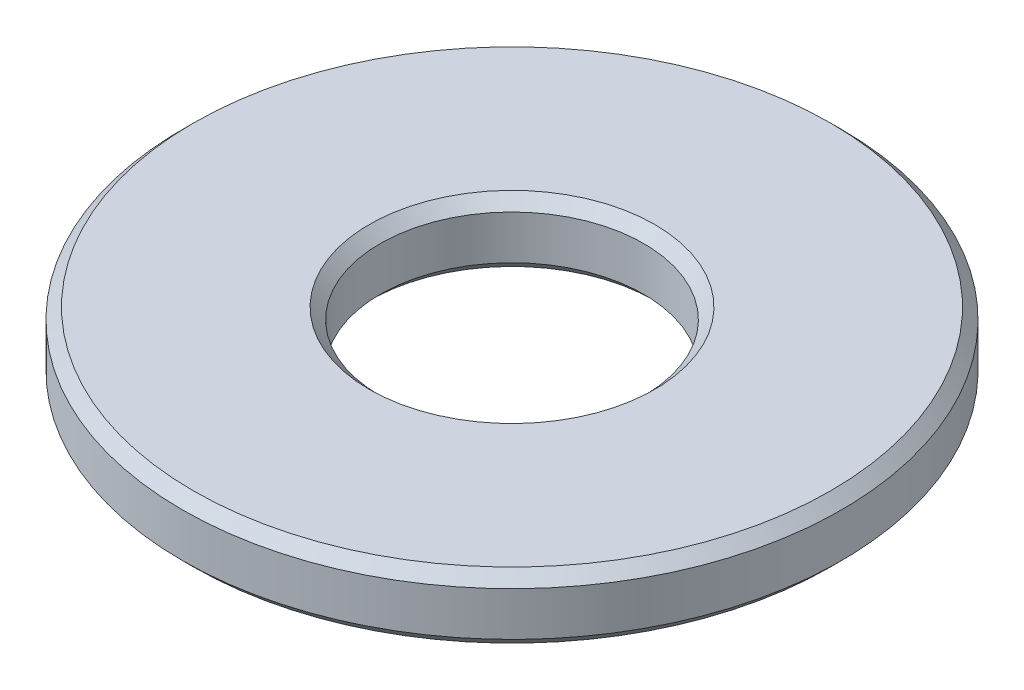
from build123d import *

# Parameters (mm, degrees)
SKETCH_1_R      = 15
SKETCH_1_R_2    = 6
EXTRUDE_1_DEPTH = 3
CHAMFER_1_SIZE  = 0.5


with BuildPart() as part:
    # Эскиз1 → Бобышка-Вытянуть1 (new body)
    with BuildSketch(Plane(origin=(0, 0, 0), x_dir=(1, 0, 0), z_dir=(0, 1, 0))):
        with Locations(Location((0, 0, 0), (0, 0, 270))):
            Circle(SKETCH_1_R)
        with Locations(Location((0, 0, 0), (0, 0, 270))):
            Circle(SKETCH_1_R_2, mode=Mode.SUBTRACT)
    extrude(amount=EXTRUDE_1_DEPTH)

    # Фаска1
    chamfer_1_edges = [part.edges().sort_by_distance(p)[0] for p in [
        (0, 0, -15),
        (0, 3, -15),
        (0, 0, -6),
        (0, 3, -6),
    ]]
    chamfer(chamfer_1_edges, length=CHAMFER_1_SIZE)


solid = part.part
